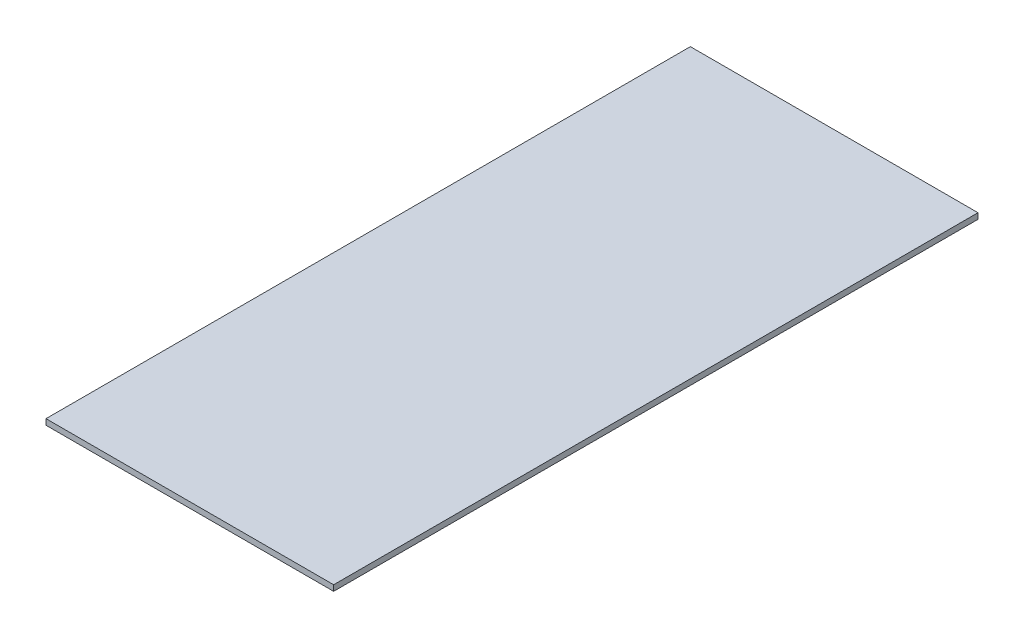
from build123d import *

# Parameters (mm, degrees)
SKETCH1_W           = 158.75
SKETCH1_H           = 355.6
BOSS_EXTRUDE1_DEPTH = 3.175


with BuildPart() as part:
    # Sketch1 → Boss-Extrude1 (new body)
    with BuildSketch(Plane(origin=(0, 0, 0), x_dir=(1, 0, 0), z_dir=(0, 1, 0))):
        with Locations((79.375, 177.8)):
            Rectangle(SKETCH1_W, SKETCH1_H)
    extrude(amount=BOSS_EXTRUDE1_DEPTH)


solid = part.part
